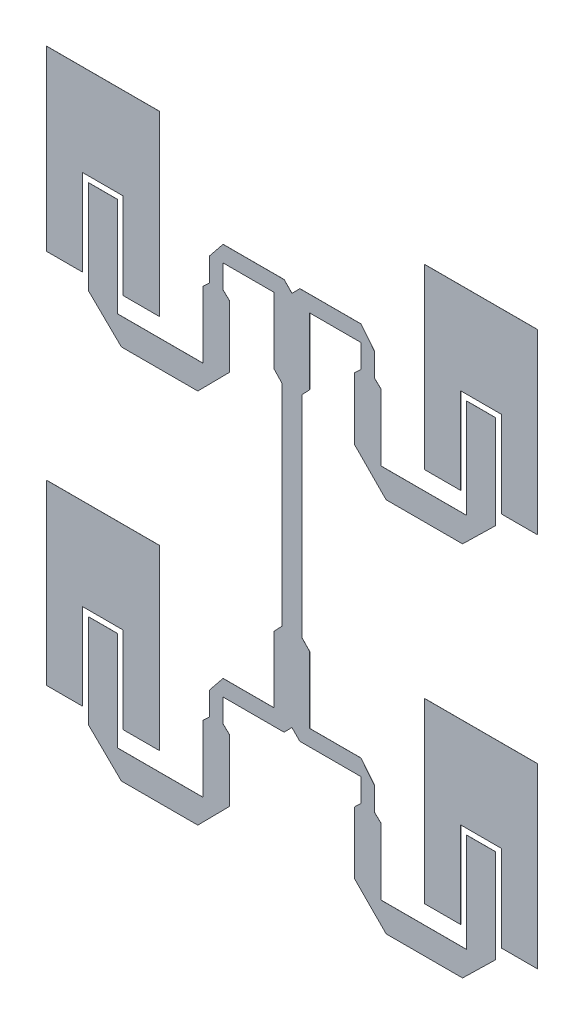
from build123d import *

# Parameters (mm, degrees)
FEED_DEPTH    = 0.018
PATCH_DEPTH   = 0.018
PATCH_2_DEPTH = 0.018
PATCH_3_DEPTH = 0.018
PATCH_4_DEPTH = 0.018


with BuildPart() as part:
    # Feed1 → Feed (new body)
    with BuildSketch(Plane.XY):
        Polygon((-47.117, 41.571333333), (-40.428333333, 41.571333333), (-40.428333333, 18.626666667), (-20.616333333, 18.626666667), (-20.616333333, 34.036), (-19.092333333, 35.475333333), (-19.092333333, 40.894), (-15.959666667, 44.788666667), (-1.820333333, 44.788666667), (0, 42.926), (1.820333333, 44.788666667), (15.959666667, 44.788666667), (19.092333333, 40.894), (19.092333333, 35.475333333), (20.616333333, 34.036), (20.616333333, 18.626666667), (40.428333333, 18.626666667), (40.428333333, 41.571333333), (47.117, 41.571333333), (47.117, 19.896666667), (39.497, 12.446), (21.801666667, 12.446), (14.435666667, 19.896666667), (14.435666667, 34.205333333), (15.959666667, 35.644666667), (15.959666667, 41.063333333), (4.106333333, 41.063333333), (4.106333333, 25.654), (2.326666667, 23.791333333), (2.326666667, -24.976667027), (4.102999886, -26.839333694), (4.106333333, -42.248666667), (15.959666667, -42.248666667), (19.092333333, -46.143333333), (19.092333333, -51.562), (20.616333333, -53.001333333), (20.616333333, -68.410666667), (40.428333333, -68.410666667), (40.428333333, -45.466), (47.117, -45.466), (47.117, -67.140666667), (39.497, -74.591333333), (21.801666667, -74.591333333), (14.435666667, -67.140666667), (14.435666667, -52.832), (15.959666667, -51.392666667), (15.959666667, -45.974), (1.820333333, -45.974), (0, -44.111333333), (-1.820333333, -45.974), (-15.959666667, -45.974), (-15.959666667, -51.392666667), (-14.435666667, -52.832), (-14.435666667, -67.140666667), (-21.801666667, -74.591333333), (-39.497, -74.591333333), (-47.117, -67.140666667), (-47.117, -45.466), (-40.428333333, -45.466), (-40.428333333, -68.410666667), (-20.616333333, -68.410666667), (-20.616333333, -53.001333333), (-19.092333333, -51.562), (-19.092333333, -46.143333333), (-15.959666667, -42.248666667), (-4.106333333, -42.248666667), (-4.106333333, -26.839333333), (-2.33, -24.976666667), (-2.33, 23.791333333), (-4.106333333, 25.654), (-4.106333333, 41.063333333), (-15.959666667, 41.063333333), (-15.959666667, 35.644666667), (-14.435666667, 34.205333333), (-14.435666667, 19.896666667), (-21.801666667, 12.446), (-39.497, 12.446), (-47.117, 19.896666667), align=None)
    extrude(amount=FEED_DEPTH)


with BuildPart() as body_2:
    # Patch1 → Patch (new body)
    with BuildSketch(Plane.XY):
        Polygon((-56.853666667, 64.092666667), (-30.691666667, 64.092666667), (-30.691666667, 22.944666667), (-39.073666667, 22.944666667), (-39.073666667, 42.926), (-48.471666667, 42.926), (-48.471666667, 22.944666667), (-56.853666667, 22.944666667), align=None)
    extrude(amount=PATCH_DEPTH)


with BuildPart() as body_3:
    # Patch1 → Patch 2 (new body)
    with BuildSketch(Plane.XY):
        Polygon((39.073666667, 22.944666667), (30.691666667, 22.944666667), (30.691666667, 64.092666667), (56.853666667, 64.092666667), (56.853666667, 22.944666667), (48.471666667, 22.944666667), (48.471666667, 42.926), (39.073666667, 42.926), align=None)
    extrude(amount=PATCH_2_DEPTH)


with BuildPart() as body_4:
    # Patch1 → Patch 3 (new body)
    with BuildSketch(Plane.XY):
        Polygon((-39.073666667, -64.092666667), (-30.691666667, -64.092666667), (-30.691666667, -22.944666667), (-56.853666667, -22.944666667), (-56.853666667, -64.092666667), (-48.471666667, -64.092666667), (-48.471666667, -44.111333333), (-39.073666667, -44.111333333), align=None)
    extrude(amount=PATCH_3_DEPTH)


with BuildPart() as body_5:
    # Patch1 → Patch 4 (new body)
    with BuildSketch(Plane.XY):
        Polygon((56.853666667, -64.092666667), (48.471666667, -64.092666667), (48.471666667, -44.111333333), (39.073666667, -44.111333333), (39.073666667, -64.092666667), (30.691666667, -64.092666667), (30.691666667, -22.944666667), (56.853666667, -22.944666667), align=None)
    extrude(amount=PATCH_4_DEPTH)


solid = Compound([part.part, body_2.part, body_3.part, body_4.part, body_5.part])
